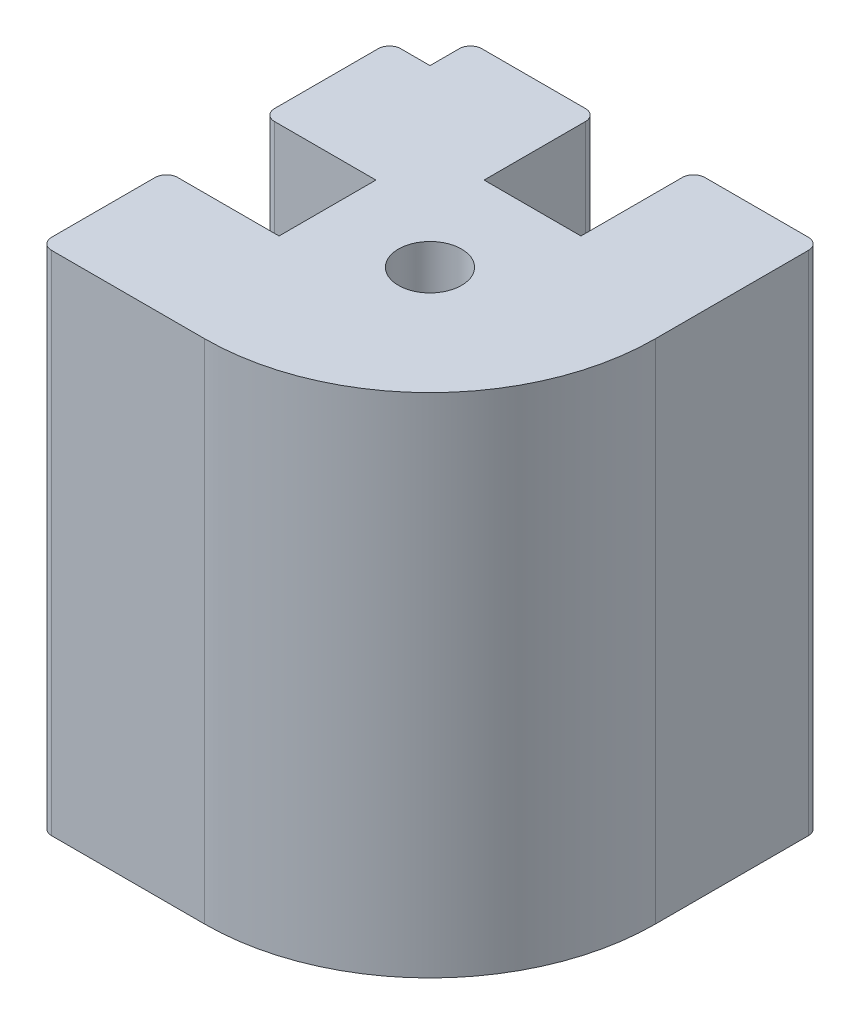
from build123d import *

# Parameters (mm, degrees)
SKETCH1_R           = 2.8
BOSS_EXTRUDE1_DEPTH = 45
FILLET1_R           = 1
FILLET2_R           = 20


with BuildPart() as part:
    # Sketch1 → Boss-Extrude1 (new body)
    with BuildSketch(Plane(origin=(0, 0, 0), x_dir=(1, 0, 0), z_dir=(0, 1, 0))):
        Polygon((-19.099152542, -15.5), (-19.099152542, -4.3), (-9.099152542, -4.3), (-9.099152542, 4.3), (-19.099152542, 4.3), (-19.099152542, 15.5), (-15.5, 15.5), (-15.5, 19.099152542), (-4.3, 19.099152542), (-4.3, 9.099152542), (4.3, 9.099152542), (4.3, 19.099152542), (15.5, 19.099152542), (15.5, -15.5), align=None)
        with Locations(Location((0, 0, 0), (0, 0, 90))):
            Circle(SKETCH1_R, mode=Mode.SUBTRACT)
    extrude(amount=BOSS_EXTRUDE1_DEPTH)

    # Fillet1
    fillet1_edges = [part.edges().sort_by_distance(p)[0] for p in [
        (-19.099152542, 22.5, 15.5),
        (-19.099152542, 22.5, 4.3),
        (-19.099152542, 22.5, -4.3),
        (-19.099152542, 22.5, -15.5),
        (-15.5, 22.5, -19.099152542),
        (-4.3, 22.5, -19.099152542),
        (4.3, 22.5, -19.099152542),
        (15.5, 22.5, -19.099152542),
    ]]
    fillet(fillet1_edges, radius=FILLET1_R)

    # Fillet2
    fillet2_edges = [part.edges().sort_by_distance(p)[0] for p in [
        (15.5, 22.5, 15.5),
    ]]
    fillet(fillet2_edges, radius=FILLET2_R)


solid = part.part
